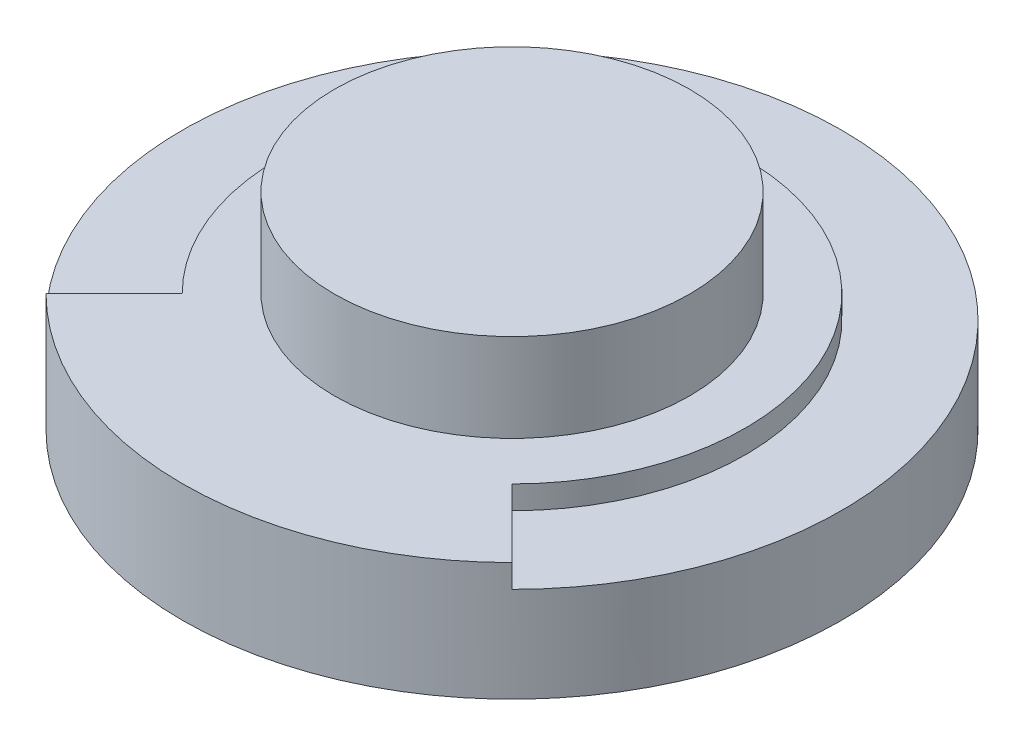
from build123d import *

# Parameters (mm, degrees)
SKETCH_1_R      = 14.2
EXTRUDE_1_DEPTH = 4.1
EXTRUDE_2_DEPTH = 1
SKETCH_2_4_R    = 7.65
EXTRUDE_3_DEPTH = 4.8


with BuildPart() as part:
    # 草图1 → 凸台-拉伸1 (new body)
    with BuildSketch(Plane(origin=(0, 0, 0), x_dir=(1, 0, 0), z_dir=(0, 1, 0))):
        Circle(SKETCH_1_R)
    extrude(amount=EXTRUDE_1_DEPTH)

    # 草图2 → 凸台-拉伸2 (add)
    with BuildSketch(Plane(origin=(0, 4.1, 0), x_dir=(1, 0, 0), z_dir=(0, 1, 0))):
        with BuildLine():
            ThreePointArc((7.106423151, -7.106423151), (0, 10.05), (-7.106423151, -7.106423151))
            Line((-7.106423151, -7.106423151), (-10.040916293, -10.040916293))
            ThreePointArc((-10.040916293, -10.040916293), (0, -14.2), (10.040916293, -10.040916293))
            Line((10.040916293, -10.040916293), (7.106423151, -7.106423151))
        make_face()
    extrude(amount=EXTRUDE_2_DEPTH)

    # 草图2<4> → 凸台-拉伸3 (add)
    with BuildSketch(Plane(origin=(0, 4.1, 0), x_dir=(1, 0, 0), z_dir=(0, 1, 0))):
        Circle(SKETCH_2_4_R)
    extrude(amount=EXTRUDE_3_DEPTH)


solid = part.part
